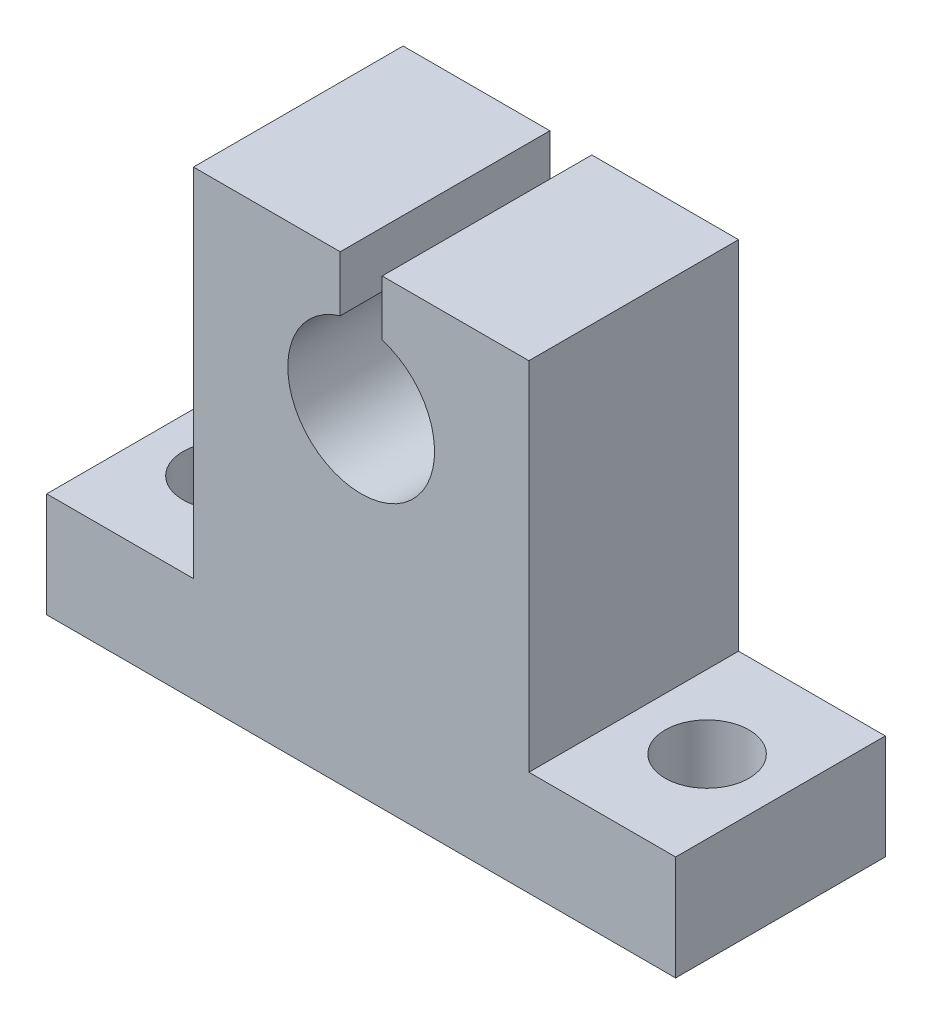
from build123d import *

# Parameters (mm, degrees)
BOSS_EXTRU_1_DEPTH      = 10
ESQUISSE4_R             = 2
ENL_V_MAT_EXTRU_1_DEPTH = 25.779023387


with BuildPart() as part:
    # Esquisse3 → Boss.-Extru.1 (new body)
    with BuildSketch(Plane.XY):
        with BuildLine():
            Line((-15, 0), (15, 0))
            Line((15, 0), (15, 5))
            Line((15, 5), (8, 5))
            Line((8, 5), (8, 22))
            Line((8, 22), (1, 22))
            Line((1, 22), (1, 19.354101966))
            ThreePointArc((1, 19.354101966), (0, 12.5), (-1, 19.354101966))
            Line((-1, 19.354101966), (-1, 22))
            Line((-1, 22), (-8, 22))
            Line((-8, 22), (-8, 5))
            Line((-8, 5), (-15, 5))
            Line((-15, 5), (-15, 0))
        make_face()
    extrude(amount=BOSS_EXTRU_1_DEPTH)

    # Esquisse4 → Enlèv. mat.-Extru.1 (cut, through all)
    with BuildSketch(Plane(origin=(0, 5, 0), x_dir=(1, 0, 0), z_dir=(0, 1, 0))):
        with Locations(Location((11.5, -5, 0), (0, 0, 180))):
            Circle(ESQUISSE4_R)
        with Locations((-11.5, -5)):
            Circle(ESQUISSE4_R)
    extrude(amount=-ENL_V_MAT_EXTRU_1_DEPTH, mode=Mode.SUBTRACT)


solid = part.part
